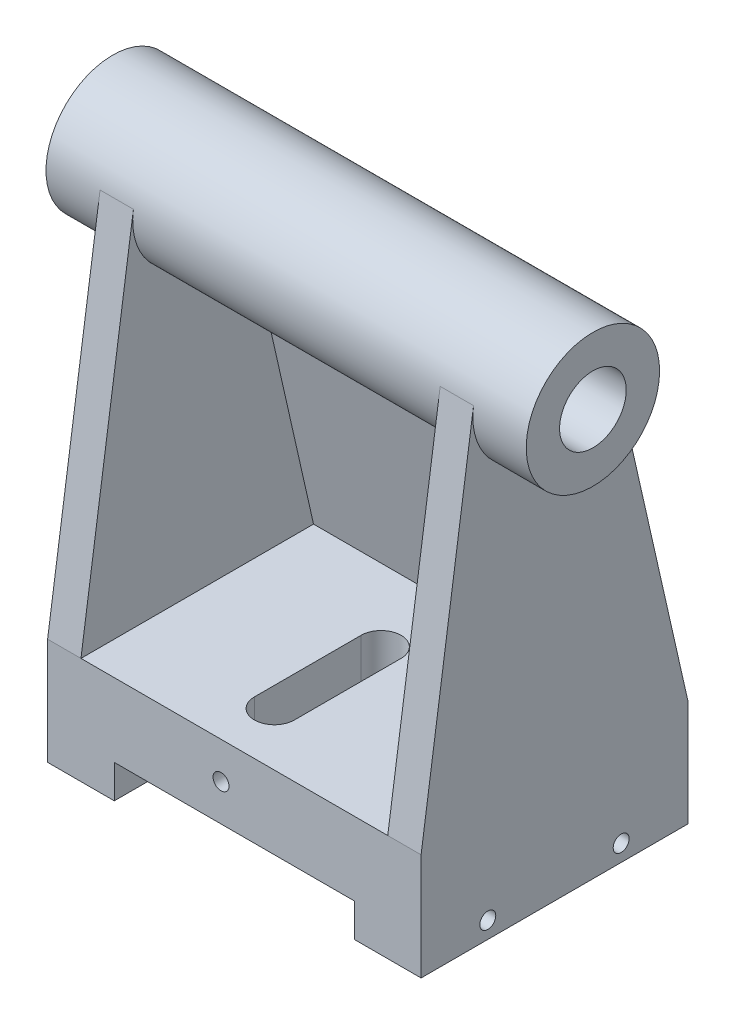
from build123d import *

# Parameters (mm, degrees)
SKETCH1_W                  = 88.9
SKETCH1_H                  = 63.5
BOSS_EXTRUDE1_DEPTH        = 12.7
SKETCH2_W                  = 57.15
SKETCH2_H                  = 7.9375
CUT_EXTRUDE1_DEPTH         = 79.545162168
F_10_24_TAPPED_HOLE1_D     = 3.7973
CUT_EXTRUDE2_DEPTH         = 25.4
BOSS_EXTRUDE2_START        = 44.45
BOSS_EXTRUDE2_DEPTH        = 7.9375
BOSS_EXTRUDE3_START        = -36.5125
BOSS_EXTRUDE3_DEPTH        = 7.9375
SKETCH7_W                  = 73.025
SKETCH7_H                  = 89.79384994
BOSS_EXTRUDE4_DEPTH        = 7.9375
SKETCH8_R                  = 15.875
SKETCH8_R_2                = 7.9375
BOSS_EXTRUDE5_DEPTH        = 57.15
F_10_24_TAPPED_HOLE2_D     = 3.7973
F_10_24_TAPPED_HOLE2_DEPTH = 15.875


with BuildPart() as part:
    # Sketch1 → Boss-Extrude1 (new, symmetric)
    with BuildSketch(Plane(origin=(0, 0, 0), x_dir=(1, 0, 0), z_dir=(0, 1, 0))):
        Rectangle(SKETCH1_W, SKETCH1_H)
    extrude(amount=BOSS_EXTRUDE1_DEPTH, both=True)

    # Sketch2 → Cut-Extrude1 (cut, through all)
    with BuildSketch(Plane.XY.offset(31.75)):
        with Locations((0, -8.73125)):
            Rectangle(SKETCH2_W, SKETCH2_H)
    extrude(amount=-CUT_EXTRUDE1_DEPTH, mode=Mode.SUBTRACT)

    # #10-24 Tapped Hole1 (through all)
    with Locations(Plane.XY.offset(31.75)):
        with Locations((-3.175, 3.96875)):
            Hole(F_10_24_TAPPED_HOLE1_D / 2)

    # Sketch5 → Cut-Extrude2 (cut)
    with BuildSketch(Plane(origin=(0, 12.7, 0), x_dir=(1, 0, 0), z_dir=(0, 1, 0))):
        with BuildLine():
            Line((-7.9375, -19.05), (-7.9375, 6.35))
            ThreePointArc((-7.9375, 6.35), (-3.175, 11.1125), (1.5875, 6.35))
            Line((1.5875, 6.35), (1.5875, -19.05))
            ThreePointArc((1.5875, -19.05), (-3.175, -23.8125), (-7.9375, -19.05))
        make_face()
    extrude(amount=-CUT_EXTRUDE2_DEPTH, mode=Mode.SUBTRACT)

    # Sketch6 → Boss-Extrude2 (add)
    with BuildSketch(Plane(origin=(0, 0, 0), x_dir=(0, 0, -1), z_dir=(1, 0, 0)).offset(BOSS_EXTRUDE2_START)):
        with BuildLine():
            Line((-31.75, 12.7), (-19.267674347, 99.045324328))
            ThreePointArc((-19.267674347, 99.045324328), (-2.928920422, 80.911389994), (11.927343936, 100.278523586))
            Line((11.927343936, 100.278523586), (31.75, 12.7))
            Line((31.75, 12.7), (-31.75, 12.7))
        make_face()
    extrude(amount=-BOSS_EXTRUDE2_DEPTH)

    # Sketch6<2> → Boss-Extrude3 (add)
    with BuildSketch(Plane(origin=(0, 0, 0), x_dir=(0, 0, -1), z_dir=(1, 0, 0)).offset(BOSS_EXTRUDE3_START)):
        with BuildLine():
            Line((-31.75, 12.7), (-19.267674347, 99.045324328))
            ThreePointArc((-19.267674347, 99.045324328), (-2.928920422, 80.911389994), (11.927343936, 100.278523586))
            Line((11.927343936, 100.278523586), (31.75, 12.7))
            Line((31.75, 12.7), (-31.75, 12.7))
        make_face()
    extrude(amount=-BOSS_EXTRUDE3_DEPTH)

    # Sketch7 → Boss-Extrude4 (add)
    with BuildSketch(Plane(origin=(0, 7.455044818, -32.937151123), x_dir=(-1, 0, 0), z_dir=(0, 0.22075739126394447, -0.9753287518587453))):
        with Locations((0, 50.274552946)):
            Rectangle(SKETCH7_W, SKETCH7_H)
    extrude(amount=-BOSS_EXTRUDE4_DEPTH)

    # Sketch8 → Boss-Extrude5 (add, symmetric)
    with BuildSketch(Plane(origin=(0, 0, 0), x_dir=(0, 0, -1), z_dir=(1, 0, 0))):
        with Locations((-3.556, 96.774)):
            Circle(SKETCH8_R)
        with Locations((-3.556, 96.774)):
            Circle(SKETCH8_R_2, mode=Mode.SUBTRACT)
    extrude(amount=BOSS_EXTRUDE5_DEPTH, both=True)

    # #10-24 Tapped Hole2
    with Locations(Plane(origin=(44.45, 0, 0), x_dir=(0, 0, -1), z_dir=(1, 0, 0))):
        with Locations((-15.875, -8.73125), (15.875, -8.73125)):
            Hole(F_10_24_TAPPED_HOLE2_D / 2, depth=F_10_24_TAPPED_HOLE2_DEPTH)


solid = part.part
